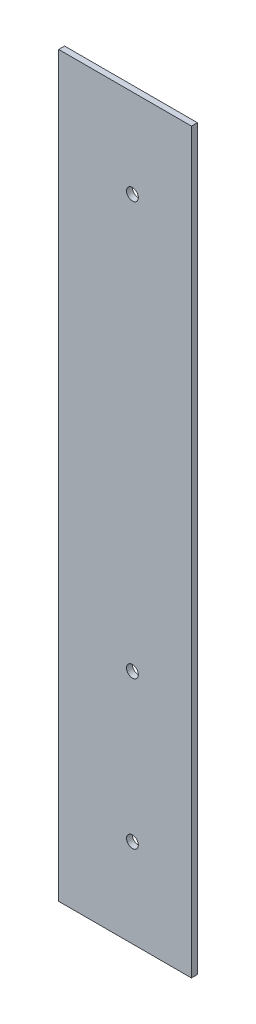
from build123d import *

# Parameters (mm, degrees)
SKETCH1_W           = 45
SKETCH1_H           = 200
BOSS_EXTRUDE1_DEPTH = 2
SKETCH2_R           = 2
CUT_EXTRUDE1_DEPTH  = 103.519510338
SKETCH5_W           = 45
SKETCH5_H           = 2
BOSS_EXTRUDE3_DEPTH = 50
SKETCH6_R           = 2
CUT_EXTRUDE3_DEPTH  = 50


with BuildPart() as part:
    # Sketch1 → Boss-Extrude1 (new body)
    with BuildSketch(Plane.XY):
        Rectangle(SKETCH1_W, SKETCH1_H)
    extrude(amount=BOSS_EXTRUDE1_DEPTH)

    # Sketch2 → Cut-Extrude1 (cut, through all)
    with BuildSketch(Plane.XY.offset(2)):
        with Locations((2.5, -70)):
            Circle(SKETCH2_R)
        with Locations((2.5, 70)):
            Circle(SKETCH2_R)
    extrude(amount=-CUT_EXTRUDE1_DEPTH, mode=Mode.SUBTRACT)

    # Sketch5 → Boss-Extrude3 (add)
    with BuildSketch(Plane.XZ.offset(100)):
        with Locations((0, 1)):
            Rectangle(SKETCH5_W, SKETCH5_H)
    extrude(amount=BOSS_EXTRUDE3_DEPTH)

    # Sketch6 → Cut-Extrude3 (cut)
    with BuildSketch(Plane(origin=(0, 0, 0), x_dir=(-1, 0, 0), z_dir=(0, 0, -1))):
        with Locations((-2.5, -120)):
            Circle(SKETCH6_R)
    extrude(amount=-CUT_EXTRUDE3_DEPTH, mode=Mode.SUBTRACT)


solid = part.part
